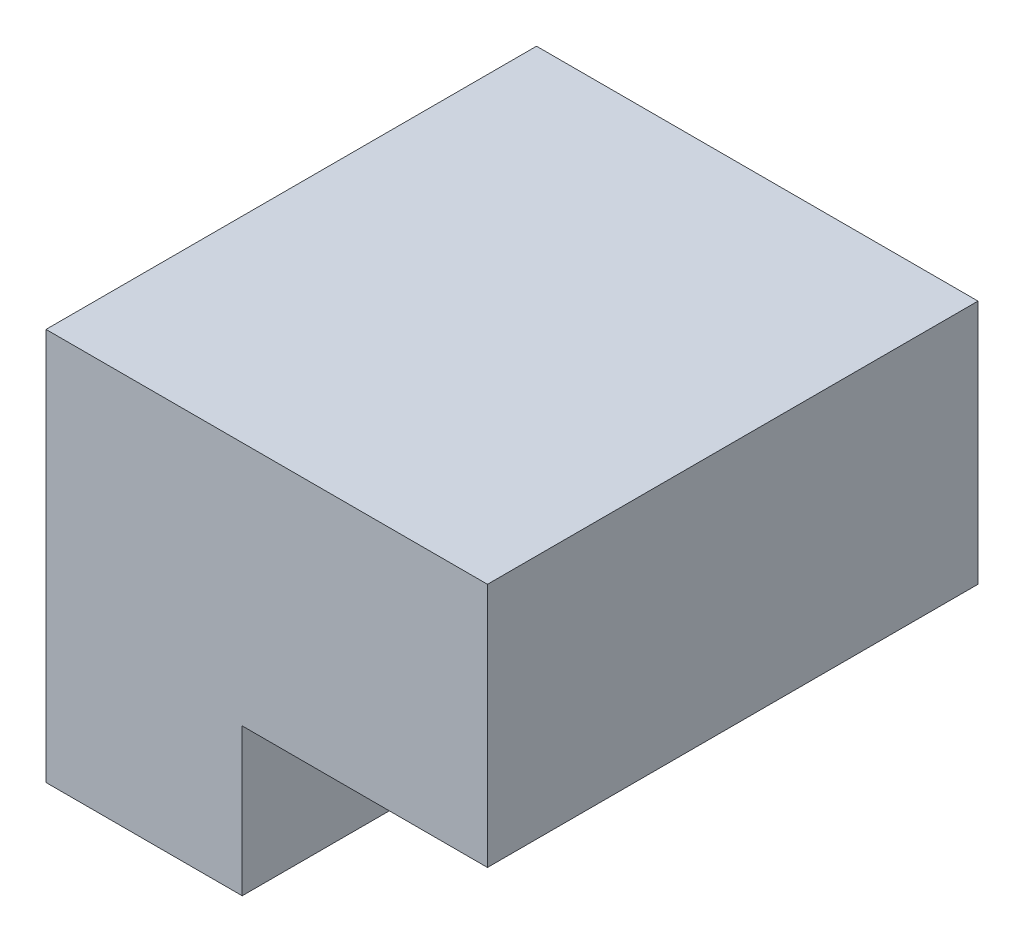
from build123d import *

# Parameters (mm, degrees)
BOSS_EXTRUDE1_DEPTH = 10


with BuildPart() as part:
    # Sketch1 → Boss-Extrude1 (new body)
    with BuildSketch(Plane.XY):
        Polygon((0, 0), (0, 8), (9, 8), (9, 3), (4, 3), (4, 0), align=None)
    extrude(amount=BOSS_EXTRUDE1_DEPTH)


solid = part.part
